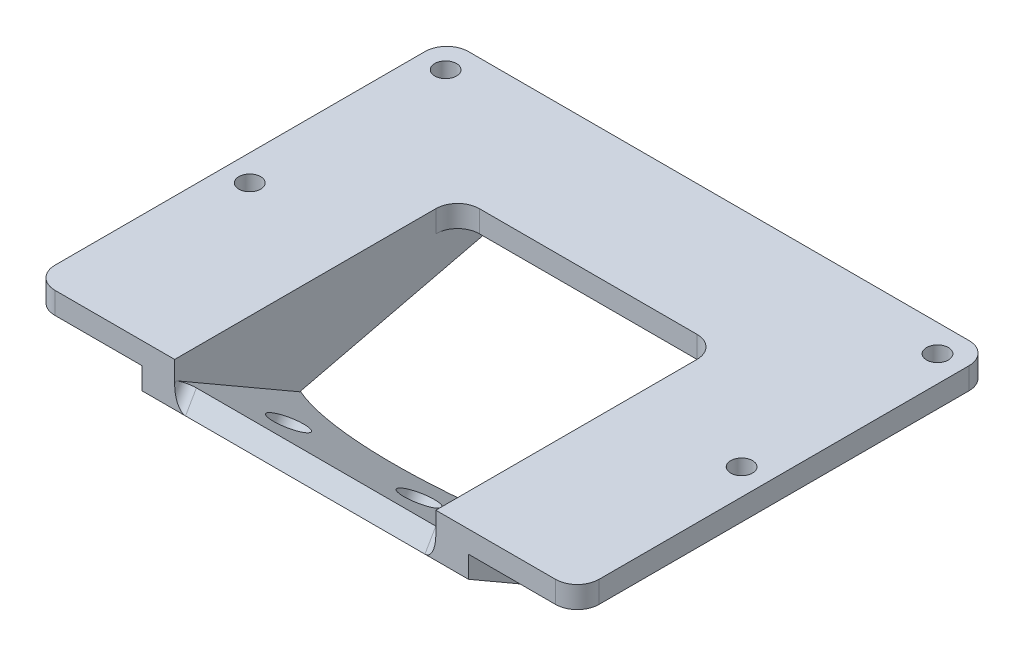
from build123d import *

# Parameters (mm, degrees)
SKETCH_1_W          = 50
SKETCH_1_H          = 38
SKETCH_1_R          = 1.0000000000000018
SKETCH_1_R_2        = 1.0000000000000016
EXTRUDE_1_DEPTH     = 2
EXTRUDE_2_DEPTH     = 3
SKETCH_5_W          = 24
SKETCH_5_H          = 26
CUT_EXTRUDE_1_DEPTH = 33.66496594212216
FILLET_1_R          = 2
EXTRUDE_6_DEPTH     = 2
CUT_EXTRUDE_2_REACH = 38.993
FILLET_2_R          = 1
CUT_EXTRUDE_3_REACH = 37.814
SKETCH_8_R          = 1.6
SKETCH_8_R_2        = 1.6000000000000019


with BuildPart() as part:
    # 草图1 → 凸台-拉伸1 (new body)
    with BuildSketch(Plane(origin=(0, 0, 0), x_dir=(1, 0, 0), z_dir=(0, 1, 0))):
        Rectangle(SKETCH_1_W, SKETCH_1_H)
        with Locations(Location((-22.600000000000005, 16.500000000000004, 0), (0, 0, 270))):
            Circle(SKETCH_1_R, mode=Mode.SUBTRACT)
        with Locations(Location((-22.600000000000005, -1.4999999999999944, 0), (0, 0, 270))):
            Circle(SKETCH_1_R_2, mode=Mode.SUBTRACT)
        with Locations(Location((22.599999999999998, 16.500000000000004, 0), (0, 0, 270))):
            Circle(SKETCH_1_R, mode=Mode.SUBTRACT)
        with Locations(Location((22.599999999999998, -1.4999999999999944, 0), (0, 0, 270))):
            Circle(SKETCH_1_R_2, mode=Mode.SUBTRACT)
    extrude(amount=EXTRUDE_1_DEPTH)

    # 草图3 → 凸台-拉伸2 (add)
    with BuildSketch(Plane(origin=(12, 0, 0), x_dir=(0, 0, -1), z_dir=(1, 0, 0))):
        Polygon((-18.999999999999996, -2), (-10.339745962155614, -7.000000000000011), (19.000000000000004, 0), (-18.999999999999996, 0), align=None)
    extrude_2 = extrude(amount=EXTRUDE_2_DEPTH)

    # 镜向1: 凸台-拉伸2 across plane
    add(extrude_2.mirror(Plane(origin=(0, 0, 0), x_dir=(0, 0, 1), z_dir=(1, 0, 0))))

    # 草图5 → 切除-拉伸1 (cut, through all)
    with BuildSketch(Plane(origin=(0, 2, 0), x_dir=(1, 0, 0), z_dir=(0, 1, 0))):
        with Locations((0, -5.9999999999999964)):
            Rectangle(SKETCH_5_W, SKETCH_5_H)
    extrude(amount=-CUT_EXTRUDE_1_DEPTH, mode=Mode.SUBTRACT)

    # 圆角1
    fillet_1_edges = [part.edges().sort_by_distance(p)[0] for p in [
        (12, 1, -7.000000000000003),
        (-12, 1, -7.000000000000003),
        (25.000000000000004, 1, 18.999999999999996),
        (-24.999999999999996, 1, 18.999999999999996),
        (-24.999999999999996, 1, -19.000000000000004),
        (25.000000000000004, 1, -19.000000000000004),
    ]]
    fillet(fillet_1_edges, radius=FILLET_1_R)

    # 草图6 → 凸台-拉伸6 (add)
    with BuildSketch(Plane(origin=(0, -9.72724133595218, 5.616025403784458), x_dir=(1, 0, 0), z_dir=(0, -0.866025403784438, 0.5000000000000011))):
        Polygon((-15, 15.45448267190432), (15, 15.45448267190432), (15, -0.5455173280956814), (-14.999999999999998, -0.5455173280956814), align=None)
    extrude(amount=-EXTRUDE_6_DEPTH)

    # 草图7 → 切除-拉伸2 (cut, up to next)
    with BuildSketch(Plane(origin=(0, -9.72724133595218, 5.616025403784458), x_dir=(1, 0, 0), z_dir=(0, -0.866025403784438, 0.5000000000000011)), mode=Mode.PRIVATE) as cut_extrude_2_sk1:
        with BuildLine():
            Line((-14.999999999999998, -0.5455173280956823), (15, -0.5455173280956823))
            Line((15, -0.5455173280956823), (14.999999999999996, 0.45448267190431774))
            ThreePointArc((14.999999999999996, 0.45448267190431774), (-3.22e-15, 7.225726116581361), (-14.999999999999998, 0.454482671904316))
            Line((-14.999999999999998, 0.454482671904316), (-14.999999999999998, -0.5455173280956823))
        make_face()
    cut_extrude_2_tool1 = extrude(cut_extrude_2_sk1.sketch, amount=-CUT_EXTRUDE_2_REACH, mode=Mode.PRIVATE) & part.part
    add(cut_extrude_2_tool1.solids().sort_by_distance((0, -8.409568, 7.898302))[0], mode=Mode.SUBTRACT)

    # 圆角2
    fillet_2_edges = [part.edges().sort_by_distance(p)[0] for p in [
        (-12, -1.133974596215562, 18.499999999999996),
        (12, -1.1339745962155647, 18.499999999999993),
        (14.999999999999996, -8.63397459621558, 5.5096189432334235),
        (-15, -8.633974596215584, 5.509618943233422),
    ]]
    fillet(fillet_2_edges, radius=FILLET_2_R)

    # 草图8 → 切除-拉伸3 (cut, up to next)
    with BuildSketch(Plane(origin=(0, -7.9951905283833, 4.616025403784459), x_dir=(1, 0, 0), z_dir=(0, 0.866025403784438, -0.5000000000000012)), mode=Mode.PRIVATE) as cut_extrude_3_sk1:
        with Locations(Location((-5.999999999999998, -11.454482671904318, 0), (0, 0, 270))):
            Circle(SKETCH_8_R)
    cut_extrude_3_tool1 = extrude(cut_extrude_3_sk1.sketch, amount=-CUT_EXTRUDE_3_REACH, mode=Mode.PRIVATE) & part.part
    # 草图8 → 切除-拉伸3 (cut, up to next)
    with BuildSketch(Plane(origin=(0, -7.9951905283833, 4.616025403784459), x_dir=(1, 0, 0), z_dir=(0, 0.866025403784438, -0.5000000000000012)), mode=Mode.PRIVATE) as cut_extrude_3_sk2:
        with Locations(Location((6.000000000000002, -11.454482671904316, 0), (0, 0, 270))):
            Circle(SKETCH_8_R_2)
    cut_extrude_3_tool2 = extrude(cut_extrude_3_sk2.sketch, amount=-CUT_EXTRUDE_3_REACH, mode=Mode.PRIVATE) & part.part
    add(cut_extrude_3_tool1.solids().sort_by_distance((-6, -2.267949, 14.535898))[0], mode=Mode.SUBTRACT)
    add(cut_extrude_3_tool2.solids().sort_by_distance((6, -2.267949, 14.535898))[0], mode=Mode.SUBTRACT)


solid = part.part
